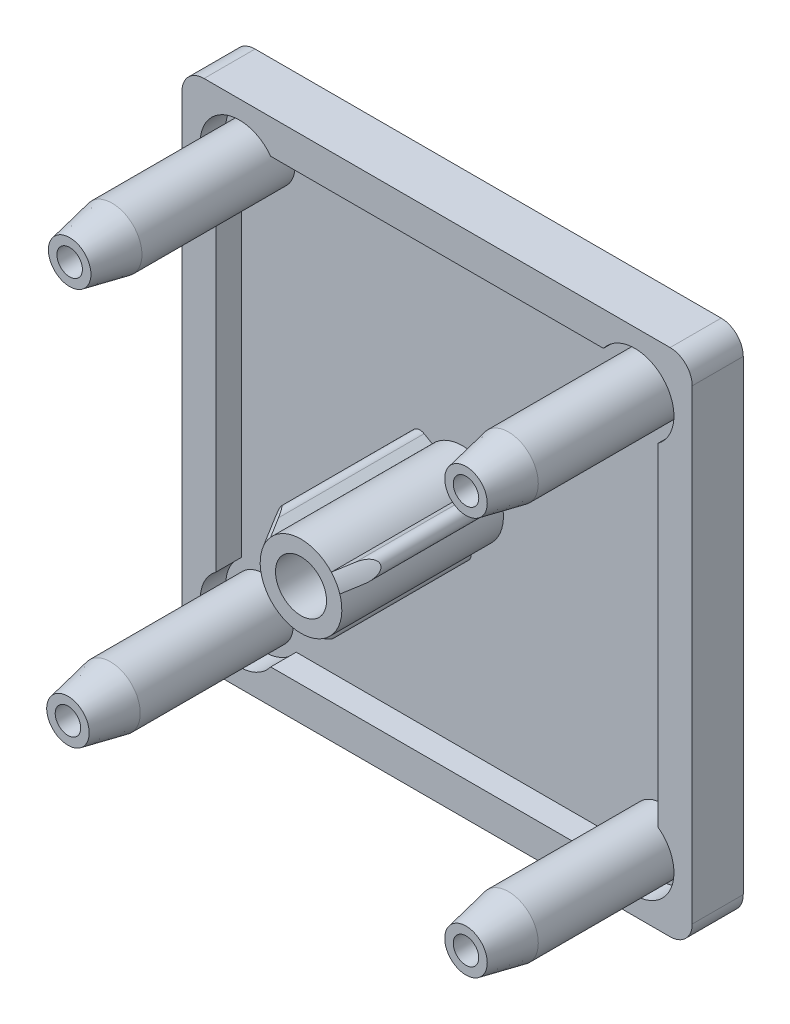
from build123d import *

# Parameters (mm, degrees)
BOSS_EXTRUDE1_DEPTH = 3
CUT_EXTRUDE1_DEPTH  = 1.5
SKETCH8_R           = 6
CUT_EXTRUDE2_DEPTH  = 10


with BuildPart() as part:
    # Sketch1 → Boss-Extrude1 (new body)
    with BuildSketch(Plane.XY):
        with BuildLine():
            Line((-15, 13.7), (-15, -13.7))
            ThreePointArc((-15, -13.7), (-14.619238816, -14.619238816), (-13.7, -15))
            Line((-13.7, -15), (13.7, -15))
            ThreePointArc((13.7, -15), (14.619238816, -14.619238816), (15, -13.7))
            Line((15, -13.7), (15, 13.7))
            ThreePointArc((15, 13.7), (14.619238816, 14.619238816), (13.7, 15))
            Line((13.7, 15), (-13.7, 15))
            ThreePointArc((-13.7, 15), (-14.619238816, 14.619238816), (-15, 13.7))
        make_face()
    extrude(amount=-BOSS_EXTRUDE1_DEPTH)

    # Sketch2 → Cut-Extrude1 (cut)
    with BuildSketch(Plane.XY):
        with BuildLine():
            Line((-13, 9.781260593), (-13, -9.781260593))
            ThreePointArc((-13, -9.781260593), (-13.251345597, -13.251345597), (-9.781260593, -13))
            Line((-9.781260593, -13), (9.781260593, -13))
            ThreePointArc((9.781260593, -13), (13.251345597, -13.251345597), (13, -9.781260593))
            Line((13, -9.781260593), (13, 9.781260593))
            ThreePointArc((13, 9.781260593), (13.251345597, 13.251345597), (9.781260593, 13))
            Line((9.781260593, 13), (-9.781260593, 13))
            ThreePointArc((-9.781260593, 13), (-13.251345597, 13.251345597), (-13, 9.781260593))
        make_face()
    extrude(amount=-CUT_EXTRUDE1_DEPTH, mode=Mode.SUBTRACT)

    # Sketch3 → Revolve1 (revolve)
    with BuildSketch(Plane(origin=(-11.6, 0, 0), x_dir=(0, 0, -1), z_dir=(1, 0, 0)), mode=Mode.PRIVATE) as revolve1_sk:
        Polygon((0, 11.7), (0, 12.45), (-10, 12.45), (-10, 12.95), (-7.5, 13.45), (1.5, 13.45), (1.5, 11.7), align=None)
    revolve(revolve1_sk.sketch.rotate(Axis((-11.6, 11.7, -1.5), (0, 0, 1)), 270), axis=Axis((-11.6, 11.7, -1.5), (0, 0, 1)))

    # Sketch4 → Revolve2 (revolve)
    with BuildSketch(Plane(origin=(11.7, 0, 0), x_dir=(0, 0, -1), z_dir=(1, 0, 0)), mode=Mode.PRIVATE) as revolve2_sk:
        Polygon((0, 11.7), (0, 12.45), (-10, 12.45), (-10, 12.95), (-7.5, 13.45), (1.5, 13.45), (1.5, 11.7), align=None)
    revolve(revolve2_sk.sketch.rotate(Axis((11.7, 11.7, -1.5), (0, 0, 1)), 270), axis=Axis((11.7, 11.7, -1.5), (0, 0, 1)))

    # Sketch5 → Revolve3 (revolve)
    with BuildSketch(Plane(origin=(11.7, 0, 0), x_dir=(0, 0, -1), z_dir=(1, 0, 0)), mode=Mode.PRIVATE) as revolve3_sk:
        Polygon((0, -11.7), (0, -10.95), (-10, -10.95), (-10, -10.45), (-7.5, -9.95), (1.5, -9.95), (1.5, -11.7), align=None)
    revolve(revolve3_sk.sketch.rotate(Axis((11.7, -11.7, -1.5), (0, 0, 1)), 270), axis=Axis((11.7, -11.7, -1.5), (0, 0, 1)))

    # Sketch6 → Revolve4 (revolve)
    with BuildSketch(Plane(origin=(-11.7, 0, 0), x_dir=(0, 0, -1), z_dir=(1, 0, 0)), mode=Mode.PRIVATE) as revolve4_sk:
        Polygon((0, -11.7), (0, -10.95), (-10, -10.95), (-10, -10.45), (-7.5, -9.95), (1.5, -9.95), (1.5, -11.7), align=None)
    revolve(revolve4_sk.sketch.rotate(Axis((-11.7, -11.7, -1.5), (0, 0, 1)), 270), axis=Axis((-11.7, -11.7, -1.5), (0, 0, 1)))

    # Sketch7 → Revolve5 (revolve)
    with BuildSketch(Plane(origin=(0, 0, 0), x_dir=(0, 0, -1), z_dir=(1, 0, 0)), mode=Mode.PRIVATE) as revolve5_sk:
        Polygon((-8, 1.5), (1.5, 1.5), (1.5, 3.4), (-6.267949192, 3.4), (-8, 2.4), align=None)
    revolve(revolve5_sk.sketch.rotate(Axis((0, 0, -10), (0, 0, 1)), 270), axis=Axis((0, 0, -10), (0, 0, 1)))

    # Sketch8 → Cut-Extrude2 (cut)
    with BuildSketch(Plane.XY.offset(-1.5)):
        Circle(SKETCH8_R)
        with BuildLine():
            Line((-2.761473671, 1.016987298), (-2.282855135, 0.740656758))
            ThreePointArc((-2.282855135, 0.740656758), (-2.078460969, -1.2), (-0.5, -2.347338919))
            Line((-0.5, -2.347338919), (-0.5, -2.9))
            ThreePointArc((-0.5, -2.9), (0, -3.4), (0.5, -2.9))
            Line((0.5, -2.9), (0.5, -2.347338919))
            ThreePointArc((0.5, -2.347338919), (2.078460969, -1.2), (2.282855135, 0.740656758))
            Line((2.282855135, 0.740656758), (2.761473671, 1.016987298))
            ThreePointArc((2.761473671, 1.016987298), (2.944486373, 1.7), (2.261473671, 1.883012702))
            Line((2.261473671, 1.883012702), (1.782855135, 1.606682161))
            ThreePointArc((1.782855135, 1.606682161), (0, 2.4), (-1.782855135, 1.606682161))
            Line((-1.782855135, 1.606682161), (-2.261473671, 1.883012702))
            ThreePointArc((-2.261473671, 1.883012702), (-2.944486373, 1.7), (-2.761473671, 1.016987298))
        make_face(mode=Mode.SUBTRACT)
    extrude(amount=CUT_EXTRUDE2_DEPTH, mode=Mode.SUBTRACT)


solid = part.part
